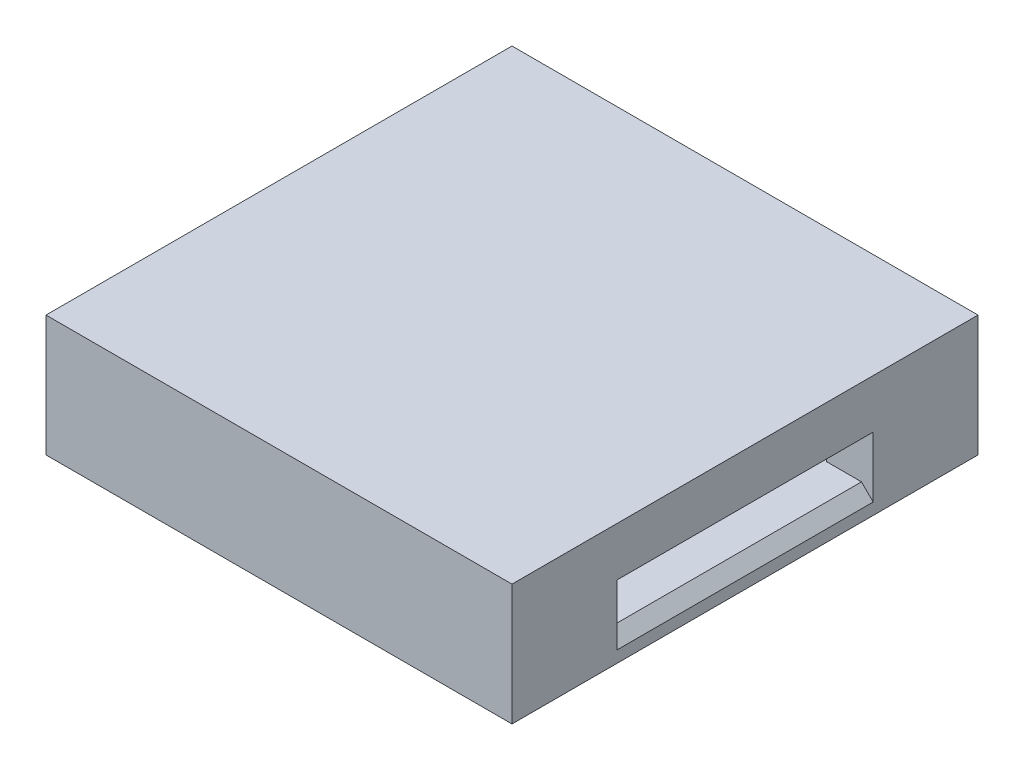
from build123d import *

# Parameters (mm, degrees)
SKETCH1_W           = 20
SKETCH1_H           = 20
BOSS_EXTRUDE1_DEPTH = 1
BOSS_EXTRUDE2_DEPTH = 2.1
CHAMFER1_SIZE       = 0.5
SKETCH3_W           = 20
SKETCH3_H           = 20
BOSS_EXTRUDE3_DEPTH = 2.1


with BuildPart() as part:
    # Sketch1 → Boss-Extrude1 (new body)
    with BuildSketch(Plane(origin=(0, 0, 0), x_dir=(1, 0, 0), z_dir=(0, 1, 0))):
        with Locations((10, 10)):
            Rectangle(SKETCH1_W, SKETCH1_H)
    extrude(amount=BOSS_EXTRUDE1_DEPTH)

    # Sketch2 → Boss-Extrude2 (add)
    with BuildSketch(Plane(origin=(0, 1, 0), x_dir=(1, 0, 0), z_dir=(0, 1, 0))):
        Polygon((18, 15.5), (20, 15.5), (20, 20), (0, 20), (0, 0), (20, 0), (20, 4.5), (18, 4.5), (18, 1.95), (2, 1.95), (2, 18.05), (18, 18.05), align=None)
    extrude(amount=BOSS_EXTRUDE2_DEPTH)

    # Chamfer1
    chamfer1_edges = [part.edges().sort_by_distance(p)[0] for p in [
        (20, 1, -10),
    ]]
    chamfer(chamfer1_edges, length=CHAMFER1_SIZE)

    # Sketch3 → Boss-Extrude3 (add)
    with BuildSketch(Plane(origin=(0, 3.1, 0), x_dir=(1, 0, 0), z_dir=(0, 1, 0))):
        with Locations((10, 10)):
            Rectangle(SKETCH3_W, SKETCH3_H)
    extrude(amount=BOSS_EXTRUDE3_DEPTH)


solid = part.part
